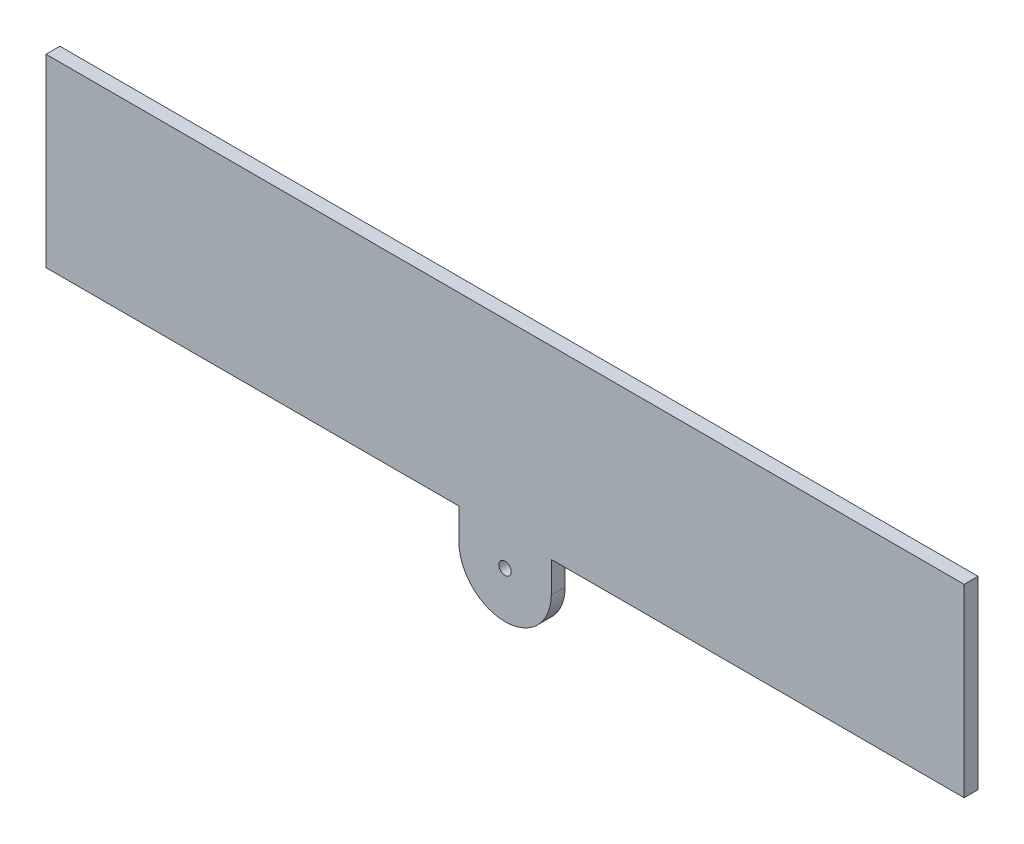
from build123d import *

# Parameters (mm, degrees)
SKETCH1_W           = 75.692
SKETCH1_H           = 15.24
BOSS_EXTRUDE1_DEPTH = 1.143
SKETCH2_R           = 0.508
BOSS_EXTRUDE2_DEPTH = 1.143


with BuildPart() as part:
    # Sketch1 → Boss-Extrude1 (new body)
    with BuildSketch(Plane.XY):
        Rectangle(SKETCH1_W, SKETCH1_H)
    extrude(amount=BOSS_EXTRUDE1_DEPTH)

    # Sketch2 → Boss-Extrude2 (add)
    with BuildSketch(Plane.XY.offset(1.143)):
        with BuildLine():
            Line((-3.81, -7.62), (3.81, -7.62))
            Line((3.81, -7.62), (3.81, -10.16))
            ThreePointArc((3.81, -10.16), (0, -13.97), (-3.81, -10.16))
            Line((-3.81, -10.16), (-3.81, -7.62))
        make_face()
        with Locations((0, -10.16)):
            Circle(SKETCH2_R, mode=Mode.SUBTRACT)
    extrude(amount=-BOSS_EXTRUDE2_DEPTH)


solid = part.part
